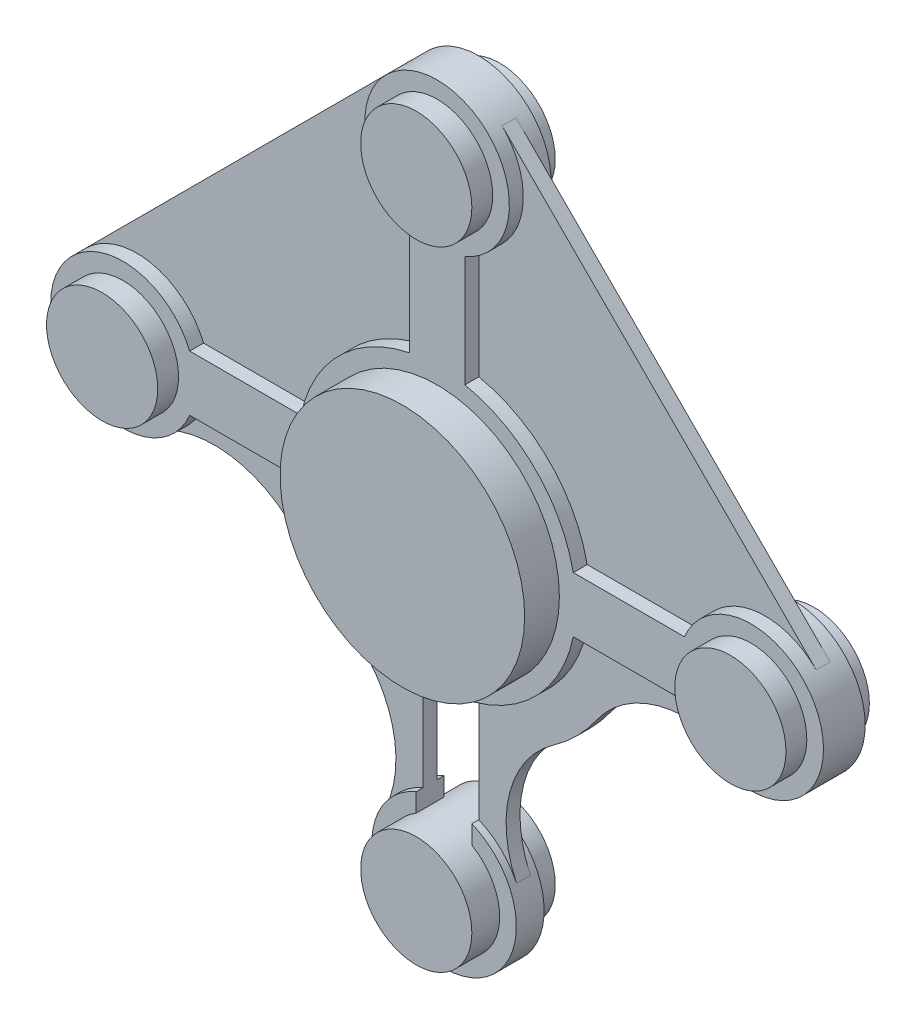
from build123d import *

# Parameters (mm, degrees)
SKETCH1_R             = 20
BOSS_EXTRUDE1_DEPTH   = 15
BOSS_EXTRUDE1_2_DEPTH = 15
BOSS_EXTRUDE1_3_DEPTH = 15
BOSS_EXTRUDE1_4_DEPTH = 15
SKETCH1_3_R           = 44
BOSS_EXTRUDE2_DEPTH   = 20
BOSS_EXTRUDE3_DEPTH   = 2.5
BOSS_EXTRUDE3_2_DEPTH = 2.5
BOSS_EXTRUDE3_3_DEPTH = 2.5
BOSS_EXTRUDE3_4_DEPTH = 2.5
BOSS_EXTRUDE5_DEPTH   = 5
SKETCH1_7_R           = 20
SKETCH1_7_R_2         = 44
BOSS_EXTRUDE6_DEPTH   = 7.5


with BuildPart() as part:
    # Sketch1 → Boss-Extrude1 (new, symmetric)
    with BuildSketch(Plane.XY):
        with Locations((0, -113)):
            Circle(SKETCH1_R)
    extrude(amount=BOSS_EXTRUDE1_DEPTH, both=True)



with BuildPart() as body_2:
    # Sketch1 → Boss-Extrude1 2 (new, symmetric)
    with BuildSketch(Plane.XY):
        with Locations((113, 0)):
            Circle(SKETCH1_R)
    extrude(amount=BOSS_EXTRUDE1_2_DEPTH, both=True)


with BuildPart() as body_3:
    # Sketch1 → Boss-Extrude1 3 (new, symmetric)
    with BuildSketch(Plane.XY):
        with Locations((0, 113)):
            Circle(SKETCH1_R)
    extrude(amount=BOSS_EXTRUDE1_3_DEPTH, both=True)


with BuildPart() as body_4:
    # Sketch1 → Boss-Extrude1 4 (new, symmetric)
    with BuildSketch(Plane.XY):
        with Locations((-113, 0)):
            Circle(SKETCH1_R)
    extrude(amount=BOSS_EXTRUDE1_4_DEPTH, both=True)


with BuildPart() as body_5:
    # Sketch1<3> → Boss-Extrude2 (new, symmetric)
    with BuildSketch(Plane.XY):
        Circle(SKETCH1_3_R)
    extrude(amount=BOSS_EXTRUDE2_DEPTH, both=True)


with BuildPart() as body_6:
    # Sketch1<4> → Boss-Extrude3 (new, symmetric)
    with BuildSketch(Plane.XY):
        with BuildLine():
            Line((131.384776311, 18.384776311), (18.384776311, 131.384776311))
            ThreePointArc((18.384776311, 131.384776311), (25.505709112, 107.954328319), (10, 89))
            Line((10, 89), (10, 48.989794856))
            ThreePointArc((10, 48.989794856), (35.355339059, 35.355339059), (48.989794856, 10))
            Line((48.989794856, 10), (89, 10))
            ThreePointArc((89, 10), (107.954328319, 25.505709112), (131.384776311, 18.384776311))
        make_face()
    extrude(amount=BOSS_EXTRUDE3_DEPTH, both=True)


with BuildPart() as body_7:
    # Sketch1<4> → Boss-Extrude3 2 (new, symmetric)
    with BuildSketch(Plane.XY):
        with BuildLine():
            ThreePointArc((-10, 89), (-25.505709112, 107.954328319), (-18.384776311, 131.384776311))
            Line((-18.384776311, 131.384776311), (-131.384776311, 18.384776311))
            ThreePointArc((-131.384776311, 18.384776311), (-107.954328319, 25.505709112), (-89, 10))
            Line((-89, 10), (-48.989794856, 10))
            ThreePointArc((-48.989794856, 10), (-35.355339059, 35.355339059), (-10, 48.989794856))
            Line((-10, 48.989794856), (-10, 89))
        make_face()
    extrude(amount=BOSS_EXTRUDE3_2_DEPTH, both=True)


with BuildPart() as body_8:
    # Sketch1<4> → Boss-Extrude3 3 (new, symmetric)
    with BuildSketch(Plane.XY):
        with BuildLine():
            ThreePointArc((52.359428182, -36.803400392), (74.773631801, -21.15717706), (102.002815768, -23.559752524))
            ThreePointArc((102.002815768, -23.559752524), (94.233874983, -17.995348061), (89, -10))
            Line((89, -10), (48.989794856, -10))
            ThreePointArc((48.989794856, -10), (35.355339059, -35.355339059), (10, -48.989794856))
            Line((10, -48.989794856), (10, -89))
            ThreePointArc((10, -89), (17.995348061, -94.233874983), (23.559752524, -102.002815768))
            ThreePointArc((23.559752524, -102.002815768), (21.15717706, -74.773631801), (36.803400392, -52.359428182))
            ThreePointArc((36.803400392, -52.359428182), (45.254833996, -45.254833996), (52.359428182, -36.803400392))
        make_face()
    extrude(amount=BOSS_EXTRUDE3_3_DEPTH, both=True)


with BuildPart() as body_9:
    # Sketch1<4> → Boss-Extrude3 4 (new, symmetric)
    with BuildSketch(Plane.XY):
        with BuildLine():
            ThreePointArc((-89, -10), (-94.233874983, -17.995348061), (-102.002815768, -23.559752524))
            ThreePointArc((-102.002815768, -23.559752524), (-74.773631801, -21.15717706), (-52.359428182, -36.803400392))
            ThreePointArc((-52.359428182, -36.803400392), (-45.254833996, -45.254833996), (-36.803400392, -52.359428182))
            ThreePointArc((-36.803400392, -52.359428182), (-21.15717706, -74.773631801), (-23.559752524, -102.002815768))
            ThreePointArc((-23.559752524, -102.002815768), (-17.995348061, -94.233874983), (-10, -89))
            Line((-10, -89), (-10, -48.989794856))
            ThreePointArc((-10, -48.989794856), (-35.355339059, -35.355339059), (-48.989794856, -10))
            Line((-48.989794856, -10), (-89, -10))
        make_face()
    extrude(amount=BOSS_EXTRUDE3_4_DEPTH, both=True)


with BuildPart() as part_1:
    add(part.part)

    add(body_8.part)  # Boss-Extrude5 merges body 8

    add(body_9.part)  # Boss-Extrude5 merges body 9
    # Sketch1<6> → Boss-Extrude5 (add, symmetric)
    with BuildSketch(Plane.XY):
        with BuildLine():
            ThreePointArc((26, -113), (25.38260788, -107.367663256), (23.559752524, -102.002815768))
            ThreePointArc((23.559752524, -102.002815768), (17.995348061, -94.233874983), (10, -89))
            Line((10, -89), (10, -95.679491924))
            ThreePointArc((10, -95.679491924), (17.320508076, -103), (20, -113))
            ThreePointArc((20, -113), (-10, -130.320508076), (-10, -95.679491924))
            Line((-10, -95.679491924), (-10, -89))
            ThreePointArc((-10, -89), (-17.995348061, -94.233874983), (-23.559752524, -102.002815768))
            ThreePointArc((-23.559752524, -102.002815768), (-5.632336744, -138.38260788), (26, -113))
        make_face()
    extrude(amount=BOSS_EXTRUDE5_DEPTH, both=True)


with BuildPart() as body_8_2:
    # Sketch1<7> → Boss-Extrude6 (new, symmetric)
    with BuildSketch(Plane.XY):
        with BuildLine():
            Line((-10, 89), (-10, 48.989794856))
            ThreePointArc((-10, 48.989794856), (-35.355339059, 35.355339059), (-48.989794856, 10))
            Line((-48.989794856, 10), (-89, 10))
            ThreePointArc((-89, 10), (-139, 0), (-89, -10))
            Line((-89, -10), (-48.989794856, -10))
            ThreePointArc((-48.989794856, -10), (0, -50), (48.989794856, -10))
            Line((48.989794856, -10), (89, -10))
            ThreePointArc((89, -10), (139, 0), (89, 10))
            Line((89, 10), (48.989794856, 10))
            ThreePointArc((48.989794856, 10), (35.355339059, 35.355339059), (10, 48.989794856))
            Line((10, 48.989794856), (10, 89))
            ThreePointArc((10, 89), (0, 139), (-10, 89))
        make_face()
        with Locations((0, 113)):
            Circle(SKETCH1_7_R, mode=Mode.SUBTRACT)
        Circle(SKETCH1_7_R_2, mode=Mode.SUBTRACT)
        with Locations((113, 0)):
            Circle(SKETCH1_7_R, mode=Mode.SUBTRACT)
        with Locations((-113, 0)):
            Circle(SKETCH1_7_R, mode=Mode.SUBTRACT)
    extrude(amount=BOSS_EXTRUDE6_DEPTH, both=True)


solid = Compound([body_2.part, body_3.part, body_4.part, body_5.part, body_6.part, body_7.part, part_1.part, body_8_2.part])
